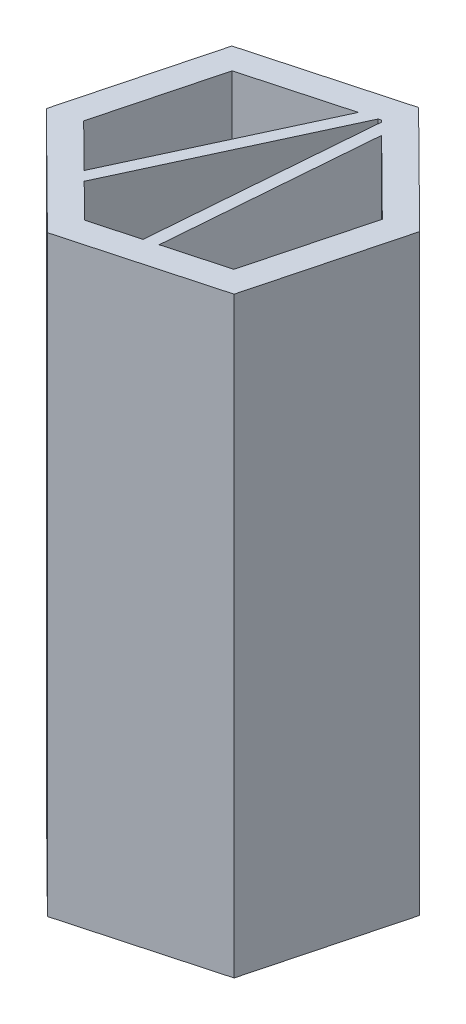
from build123d import *

# Parameters (mm, degrees)
BOSS_EXTRUDE1_DEPTH = 45
BOSS_EXTRUDE2_DEPTH = 45


with BuildPart() as part:
    # Sketch1 → Boss-Extrude1 (new body)
    with BuildSketch(Plane(origin=(0, 0, 0), x_dir=(1, 0, 0), z_dir=(0, 1, 0))):
        Polygon((8.205892182, -8.12383326), (11.13839207, 3.04459446), (2.932499888, 11.16842772), (-8.205892182, 8.12383326), (-11.13839207, -3.04459446), (-2.932499888, -11.16842772), align=None)
        Polygon((-2.345999911, -8.934742176), (6.564713745, -6.499066608), (8.910713656, 2.435675568), (2.345999911, 8.934742176), (-6.564713745, 6.499066608), (-8.910713656, -2.435675568), align=None, mode=Mode.SUBTRACT)
    extrude(amount=BOSS_EXTRUDE1_DEPTH)

    # Sketch2 → Boss-Extrude2 (add)
    with BuildSketch(Plane(origin=(0, 45, 0), x_dir=(1, 0, 0), z_dir=(0, 1, 0))):
        Polygon((-5.628356783, -5.685208872), (0.966484517, 8.557662172), (2.153077301, 8.882008253), (-4.917705674, -6.38875347), align=None)
        Polygon((2.109356917, -7.716904392), (3.36231847, 7.928586802), (2.488130132, 8.794033256), (1.144743868, -7.980574007), align=None)
    extrude(amount=-BOSS_EXTRUDE2_DEPTH)


solid = part.part
